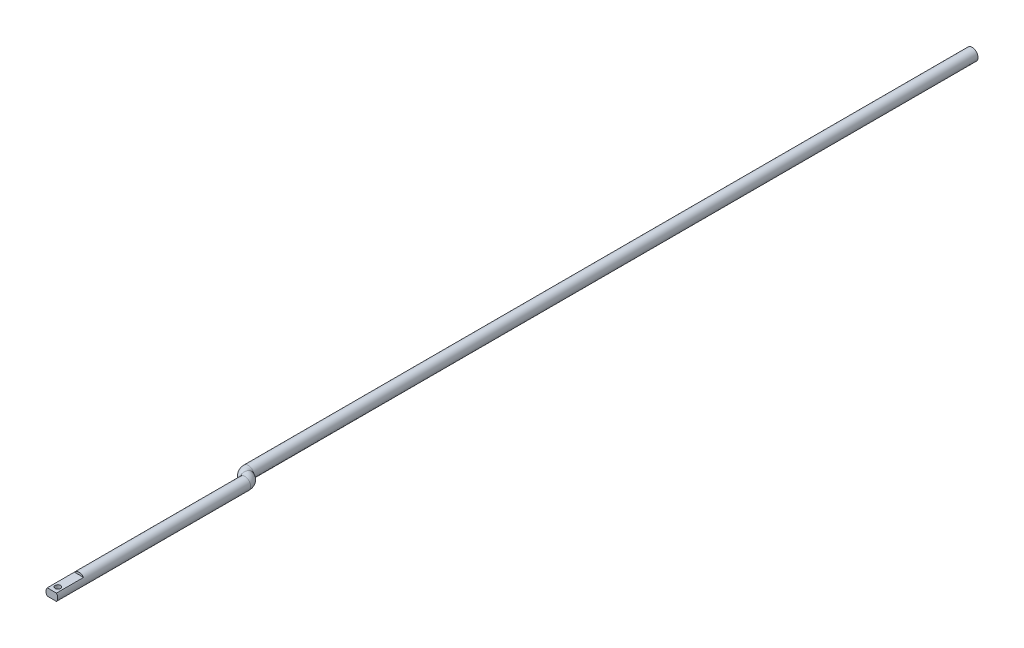
from build123d import *

# Parameters (mm, degrees)
SKETCH1_R    = 1.2319
RODEND_DEPTH = 40.64
SKETCH2_W    = 6.35
SKETCH2_H    = 2.4638
SKETCH2_W_2  = 2.4638
SKETCH2_H_2  = 1.524
FLATS_DEPTH  = 5.715
SKETCH3_R    = 0.5715
HOLE_DEPTH   = 41.707527741
SKETCH4_R    = 1.2319
REV1_ANGLE   = 70
SKETCH6_R    = 1.2319
REV2_ANGLE   = 70
SKETCH10_R   = 1.2319
SHAFT_DEPTH  = 152.4


with BuildPart() as part:
    # Sketch1 → RodEnd (new body)
    with BuildSketch(Plane.XY):
        Circle(SKETCH1_R)
    extrude(amount=-RODEND_DEPTH)

    # Sketch2 → Flats (cut)
    with BuildSketch(Plane.XY):
        Rectangle(SKETCH2_W, SKETCH2_H)
        Rectangle(SKETCH2_W_2, SKETCH2_H_2, mode=Mode.SUBTRACT)
    extrude(amount=-FLATS_DEPTH, mode=Mode.SUBTRACT)

    # Sketch3 → Hole (cut, through all)
    with BuildSketch(Plane(origin=(0, 0.762, 0), x_dir=(1, 0, 0), z_dir=(0, 1, 0))):
        with Locations(Location((0, 1.27, 0), (0, 0, 270))):
            Circle(SKETCH3_R)
    extrude(amount=-HOLE_DEPTH, mode=Mode.SUBTRACT)

    # Sketch4 → Rev1 (revolve)
    with BuildSketch(Plane(origin=(0, 0, -40.64), x_dir=(-1, 0, 0), z_dir=(0, 0, -1))):
        with Locations(Location((0, 0, 0), (0, 0, 180))):
            Circle(SKETCH4_R)
    revolve(axis=Axis((-1.27, 0, -40.64), (0, 1, 0)), revolution_arc=REV1_ANGLE)

    # Sketch6 → Rev2 (revolve)
    with BuildSketch(Plane(origin=(-14.18288245, 0, -5.162147048), x_dir=(-0.3420201433256661, 0, 0.9396926207859093), z_dir=(-0.9396926207859094, 0, -0.34202014332566616))):
        with Locations((-39.024742527, 0)):
            Circle(SKETCH6_R)
    revolve(axis=Axis((-0.401268836, 0, -43.026819257), (0, -1, 0)), revolution_arc=REV2_ANGLE)

    # Sketch10 → Shaft (add)
    with BuildSketch(Plane(origin=(0, 0, -43.026819257), x_dir=(-1, 0, 0), z_dir=(0, 0, -1))):
        with Locations((1.671268836, 0)):
            Circle(SKETCH10_R)
    extrude(amount=SHAFT_DEPTH)


solid = part.part
